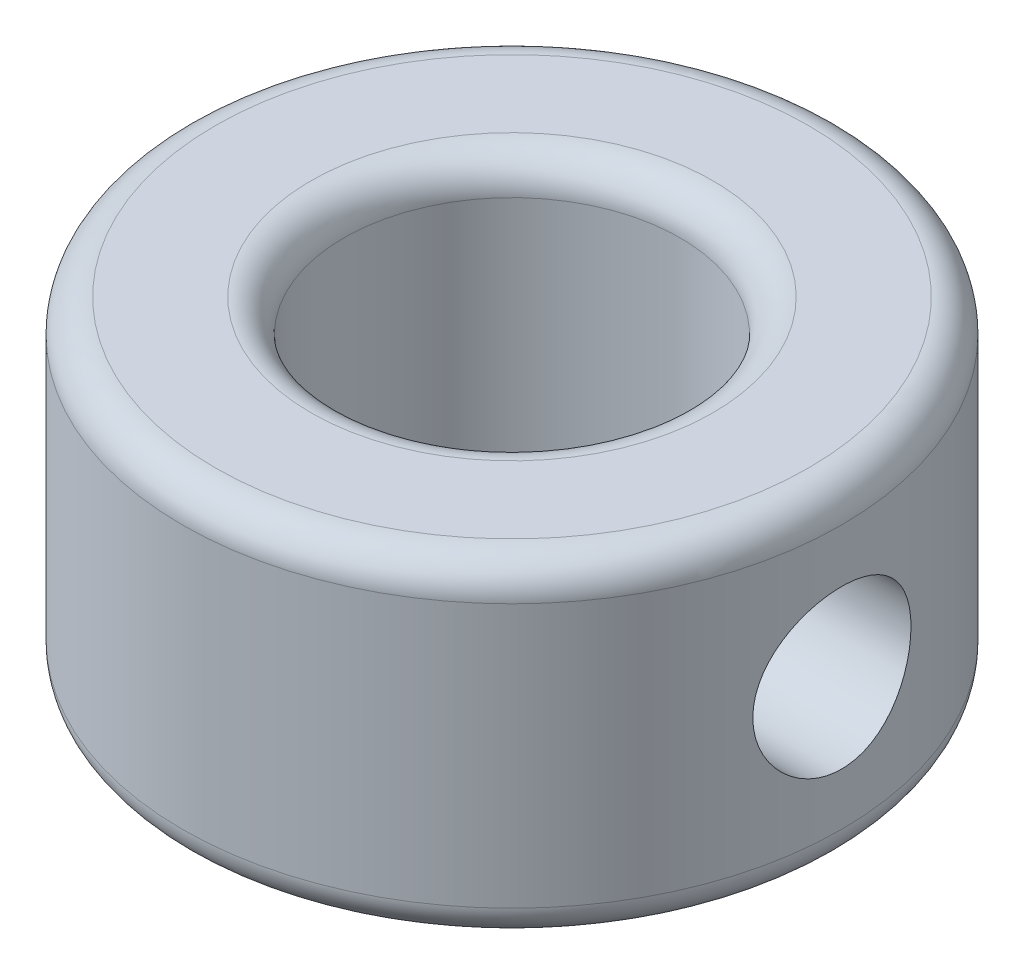
from build123d import *

# Parameters (mm, degrees)
SKETCH1_R                 = 5
SKETCH1_R_2               = 2.55
BOSS_EXTRUDE1_DEPTH       = 5
FILLET1_R                 = 0.5
F_2_5MM_DOWEL_HOLE1_D     = 2.4
F_2_5MM_DOWEL_HOLE1_DEPTH = 5
F_2_5MM_DOWEL_HOLE1_TIP   = 0.721032743


with BuildPart() as part:
    # Sketch1 → Boss-Extrude1 (new body)
    with BuildSketch(Plane(origin=(0, 0, 0), x_dir=(1, 0, 0), z_dir=(0, 1, 0))):
        with Locations(Location((0, 0, 0), (0, 0, 270))):
            Circle(SKETCH1_R)
        with Locations(Location((0, 0, 0), (0, 0, 270))):
            Circle(SKETCH1_R_2, mode=Mode.SUBTRACT)
    extrude(amount=BOSS_EXTRUDE1_DEPTH)

    # Fillet1
    fillet1_edges = [part.edges().sort_by_distance(p)[0] for p in [
        (0, 0, -5),
        (0, 5, -5),
        (0, 0, -2.55),
        (0, 5, -2.55),
    ]]
    fillet(fillet1_edges, radius=FILLET1_R)

    # Ø2.5mm Dowel Hole1
    with Locations(Plane(origin=(5, 2.491746689, 0), x_dir=(0, 0, 1), z_dir=(1, 0, 0))):
        with Locations((0, 0)):
            Hole(F_2_5MM_DOWEL_HOLE1_D / 2, depth=F_2_5MM_DOWEL_HOLE1_DEPTH)
            with Locations((0, 0, -(F_2_5MM_DOWEL_HOLE1_DEPTH + F_2_5MM_DOWEL_HOLE1_TIP / 2))):  # 118° drill point
                Cone(0, F_2_5MM_DOWEL_HOLE1_D / 2, F_2_5MM_DOWEL_HOLE1_TIP, mode=Mode.SUBTRACT)


solid = part.part
